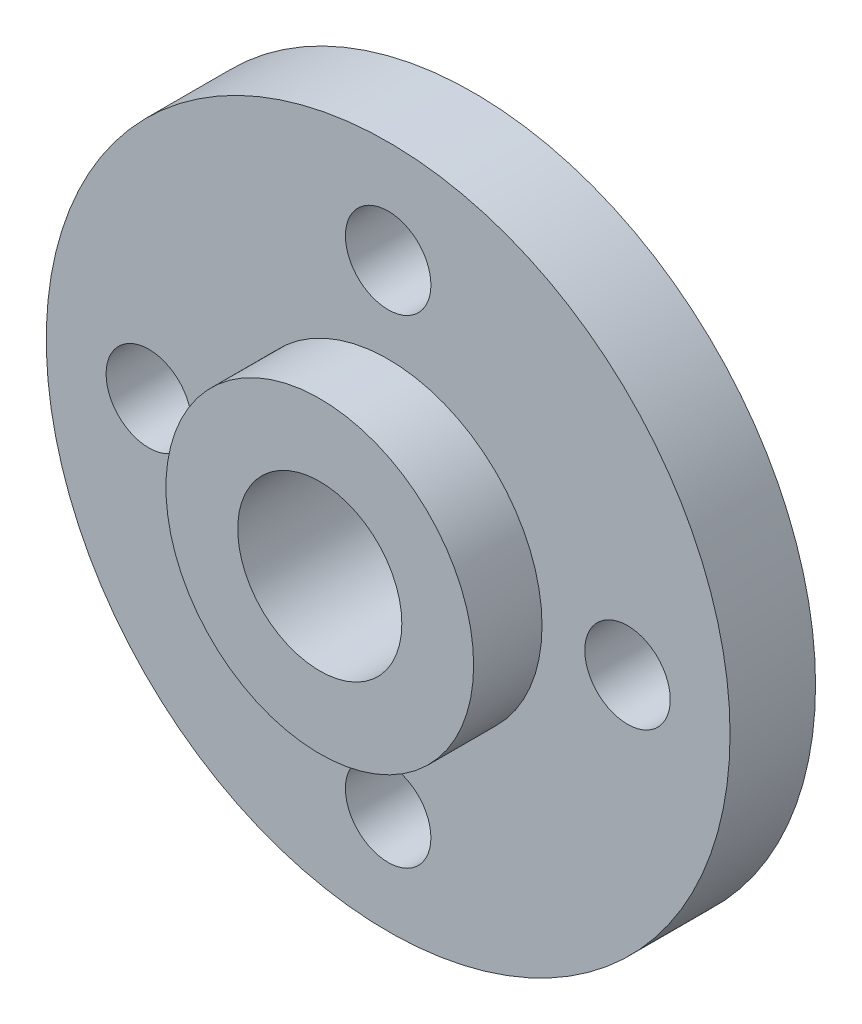
from build123d import *

# Parameters (mm, degrees)
CROQUIS1_R              = 10
SALIENTE_EXTRUIR1_DEPTH = 2.5
CROQUIS2_R              = 4.5
SALIENTE_EXTRUIR2_DEPTH = 2
CROQUIS3_R              = 2.4
CORTAR_EXTRUIR1_DEPTH   = 15.84082208
CROQUIS4_R              = 1.25
CORTAR_EXTRUIR2_DEPTH   = 15.84082208


with BuildPart() as part:
    # Croquis1 → Saliente-Extruir1 (new body)
    with BuildSketch(Plane.XY):
        Circle(CROQUIS1_R)
    extrude(amount=SALIENTE_EXTRUIR1_DEPTH)

    # Croquis2 → Saliente-Extruir2 (add)
    with BuildSketch(Plane.XY.offset(2.5)):
        Circle(CROQUIS2_R)
    extrude(amount=SALIENTE_EXTRUIR2_DEPTH)

    # Croquis3 → Cortar-Extruir1 (cut, through all)
    with BuildSketch(Plane.XY.offset(4.5)):
        Circle(CROQUIS3_R)
    extrude(amount=-CORTAR_EXTRUIR1_DEPTH, mode=Mode.SUBTRACT)

    # Croquis4 → Cortar-Extruir2 (cut, through all)
    with BuildSketch(Plane(origin=(0, 0, 0), x_dir=(-1, 0, 0), z_dir=(0, 0, -1))):
        with Locations((0, 7)):
            Circle(CROQUIS4_R)
        with Locations((7, 0)):
            Circle(CROQUIS4_R)
        with Locations((0, -7)):
            Circle(CROQUIS4_R)
        with Locations((-7, 0)):
            Circle(CROQUIS4_R)
    extrude(amount=-CORTAR_EXTRUIR2_DEPTH, mode=Mode.SUBTRACT)


solid = part.part
